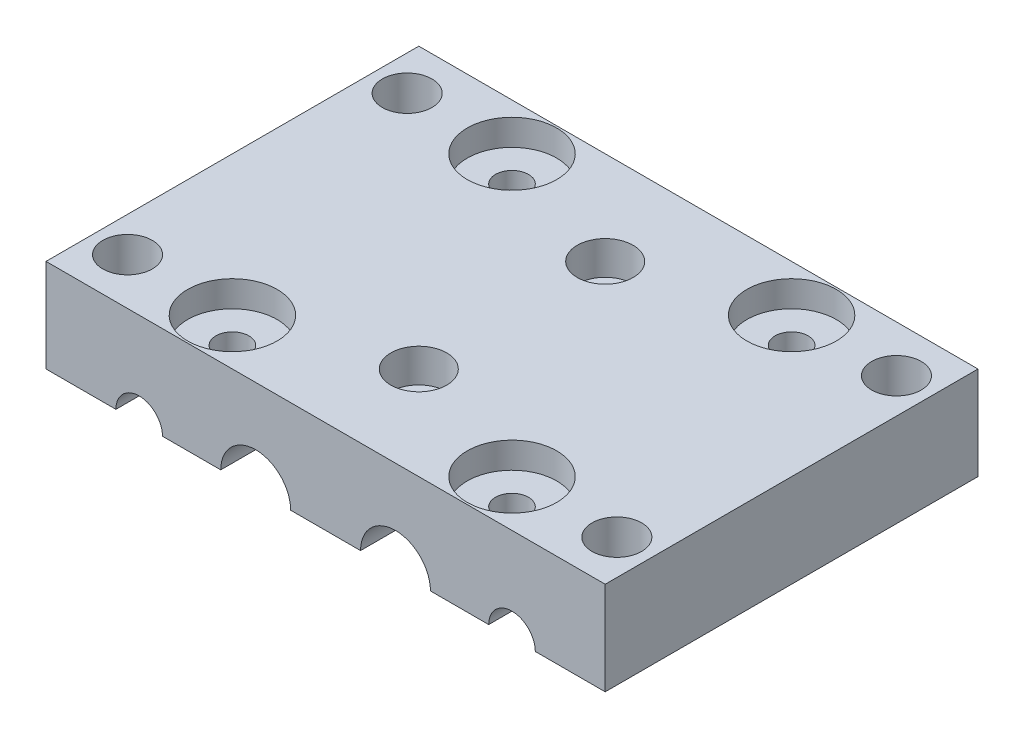
from build123d import *

# Parameters (mm, degrees)
SKETCH1_W               = 76.2
SKETCH1_H               = 50.8
BOSS_EXTRUDE1_DEPTH     = 12.7
SKETCH2_R               = 3.175
CUT_EXTRUDE1_DEPTH      = 65.757547823
SKETCH3_R               = 4.7625
CUT_EXTRUDE2_DEPTH      = 65.757547823
F_1_4_CLEARANCE_HOLE1_D = 6.7564
F_8_CLEARANCE_HOLE1_D   = 4.4958
SKETCH10_R              = 3.81
CUT_EXTRUDE3_DEPTH      = 4.572
SKETCH11_R              = 6.096
CUT_EXTRUDE4_DEPTH      = 3.556


with BuildPart() as part:
    # Sketch1 → Boss-Extrude1 (new body)
    with BuildSketch(Plane(origin=(0, 0, 0), x_dir=(1, 0, 0), z_dir=(0, 1, 0))):
        Rectangle(SKETCH1_W, SKETCH1_H)
    extrude(amount=BOSS_EXTRUDE1_DEPTH)

    # Sketch2 → Cut-Extrude1 (cut, through all)
    with BuildSketch(Plane.XY.offset(25.4)):
        with Locations((-25.4, 0)):
            Circle(SKETCH2_R)
        with Locations((25.4, 0)):
            Circle(SKETCH2_R)
    extrude(amount=-CUT_EXTRUDE1_DEPTH, mode=Mode.SUBTRACT)

    # Sketch3 → Cut-Extrude2 (cut, through all)
    with BuildSketch(Plane.XY.offset(25.4)):
        with Locations((-9.525, 0)):
            Circle(SKETCH3_R)
        with Locations((9.525, 0)):
            Circle(SKETCH3_R)
    extrude(amount=-CUT_EXTRUDE2_DEPTH, mode=Mode.SUBTRACT)

    # 1/4 Clearance Hole1 (through all)
    with Locations(Plane(origin=(0, 12.7, 0), x_dir=(1, 0, 0), z_dir=(0, 1, 0))):
        with Locations((-33.3375, -19.05), (-33.3375, 19.05), (33.3375, 19.05), (33.3375, -19.05)):
            Hole(F_1_4_CLEARANCE_HOLE1_D / 2)

    # #8 Clearance Hole1 (through all)
    with Locations(Plane(origin=(0, 12.7, 0), x_dir=(1, 0, 0), z_dir=(0, 1, 0))):
        with Locations((-19.05, 19.05), (-19.05, -19.05), (19.05, -19.05), (19.05, 19.05), (0, 12.7), (0, -12.7)):
            Hole(F_8_CLEARANCE_HOLE1_D / 2)

    # Sketch10 → Cut-Extrude3 (cut)
    with BuildSketch(Plane(origin=(0, 12.7, 0), x_dir=(1, 0, 0), z_dir=(0, 1, 0))):
        with Locations(Location((0, 12.7, 0), (0, 0, 270))):
            Circle(SKETCH10_R)
        with Locations(Location((0, -12.7, 0), (0, 0, 270))):
            Circle(SKETCH10_R)
    extrude(amount=-CUT_EXTRUDE3_DEPTH, mode=Mode.SUBTRACT)

    # Sketch11 → Cut-Extrude4 (cut)
    with BuildSketch(Plane(origin=(0, 12.7, 0), x_dir=(1, 0, 0), z_dir=(0, 1, 0))):
        with Locations(Location((-19.05, 19.05, 0), (0, 0, 270))):
            Circle(SKETCH11_R)
        with Locations(Location((-19.05, -19.05, 0), (0, 0, 270))):
            Circle(SKETCH11_R)
        with Locations(Location((19.05, -19.05, 0), (0, 0, 270))):
            Circle(SKETCH11_R)
        with Locations(Location((19.05, 19.05, 0), (0, 0, 270))):
            Circle(SKETCH11_R)
    extrude(amount=-CUT_EXTRUDE4_DEPTH, mode=Mode.SUBTRACT)


solid = part.part
